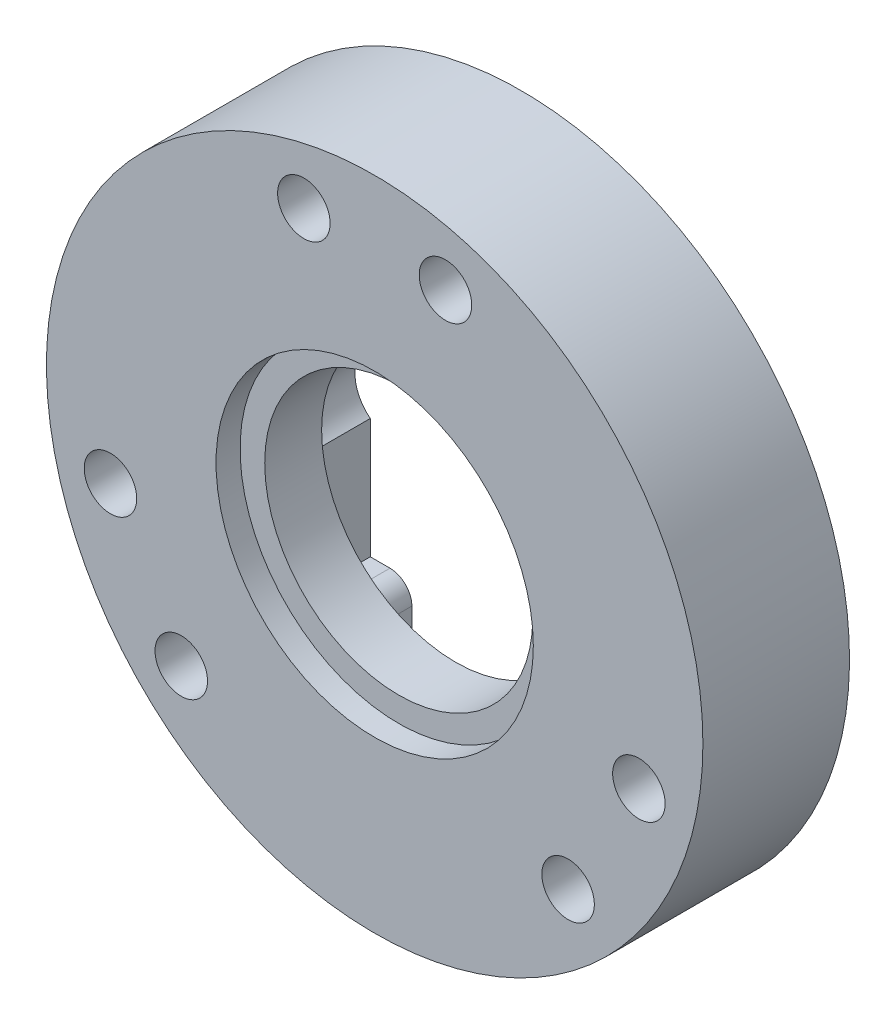
from build123d import *

# Parameters (mm, degrees)
EXTRUDE_1_DEPTH     = 3
CUT_EXTRUDE_4_DEPTH = 22.424285286
SKETCH_12_R         = 15
SKETCH_12_R_2       = 6.125
EXTRUDE_2_DEPTH     = 2.6
SKETCH_13_R         = 15
SKETCH_13_R_2       = 7.25
EXTRUDE_3_DEPTH     = 1.1
SKETCH_14_R         = 1.2
CUT_EXTRUDE_5_DEPTH = 23.246123258
FILLET_1_R          = 1


with BuildPart() as part:
    # 스케치1 → 보스-돌출1 (new body)
    with BuildSketch(Plane.XY):
        with BuildLine():
            Line((-5, -6.9), (-6.9, -6.9))
            Line((-6.9, -6.9), (-6.9, 6.9))
            Line((-6.9, 6.9), (6.9, 6.9))
            Line((6.9, 6.9), (6.9, -6.9))
            Line((6.9, -6.9), (5, -6.9))
            Line((5, -6.9), (5, -14.142135624))
            ThreePointArc((5, -14.142135624), (0, 15), (-5, -14.142135624))
            Line((-5, -14.142135624), (-5, -6.9))
        make_face()
    extrude(amount=EXTRUDE_1_DEPTH)

    # 스케치11 → 컷-돌출4 (cut, through all)
    with BuildSketch(Plane.XY.offset(3)):
        with BuildLine():
            Line((5.8, -1.8), (-5.8, -1.8))
            ThreePointArc((-5.8, -1.8), (-7.6, 0), (-5.8, 1.8))
            Line((-5.8, 1.8), (5.8, 1.8))
            ThreePointArc((5.8, 1.8), (7.6, 0), (5.8, -1.8))
        make_face()
    extrude(amount=-CUT_EXTRUDE_4_DEPTH, mode=Mode.SUBTRACT)

    # 스케치12 → 보스-돌출2 (add)
    with BuildSketch(Plane.XY.offset(3)):
        with Locations(Location((0, 0, 0), (0, 0, 250.528779366))):
            Circle(SKETCH_12_R)
        Circle(SKETCH_12_R_2, mode=Mode.SUBTRACT)
    extrude(amount=EXTRUDE_2_DEPTH)

    # 스케치13 → 보스-돌출3 (add)
    with BuildSketch(Plane.XY.offset(5.6)):
        with Locations(Location((0, 0, 0), (0, 0, 250.528779366))):
            Circle(SKETCH_13_R)
        Circle(SKETCH_13_R_2, mode=Mode.SUBTRACT)
    extrude(amount=EXTRUDE_3_DEPTH)

    # 스케치14 → 컷-돌출5 (cut, through all)
    with BuildSketch(Plane.XY.offset(6.7)):
        with Locations((3.235238064, 12.074072829)):
            Circle(SKETCH_14_R)
        with Locations((-3.235238064, 12.074072829)):
            Circle(SKETCH_14_R)
        with Locations((12.074072829, -3.235238064)):
            Circle(SKETCH_14_R)
        with Locations((8.838834765, -8.838834765)):
            Circle(SKETCH_14_R)
        with Locations((-8.838834765, -8.838834765)):
            Circle(SKETCH_14_R)
        with Locations((-12.074072829, -3.235238064)):
            Circle(SKETCH_14_R)
    extrude(amount=-CUT_EXTRUDE_5_DEPTH, mode=Mode.SUBTRACT)

    # 필렛1
    fillet_1_edges = [part.edges().sort_by_distance(p)[0] for p in [
        (-5, -6.9, 1.5),
        (5, -6.9, 1.5),
    ]]
    fillet(fillet_1_edges, radius=FILLET_1_R)


solid = part.part
